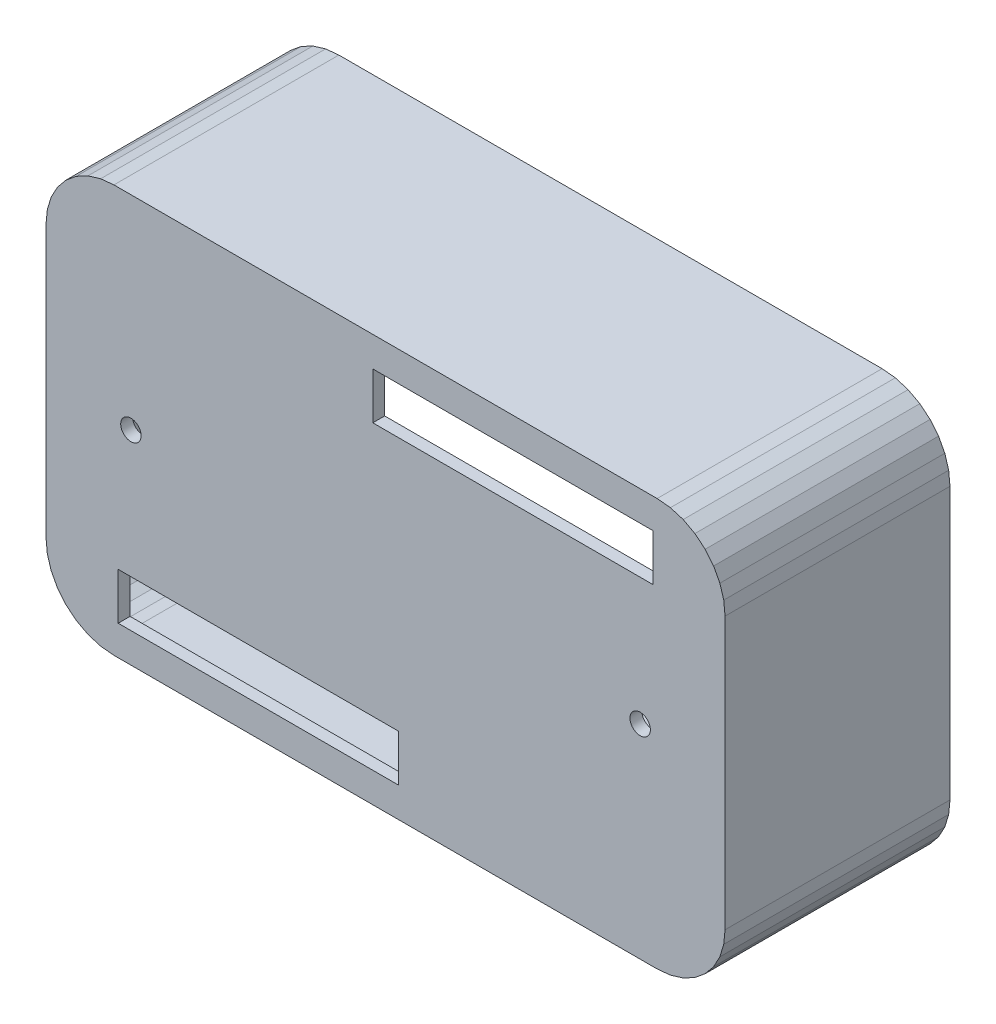
from build123d import *

# Parameters (mm, degrees)
BOSS_EXTRUDE1_START     = -2.5
BOSS_EXTRUDE1_DEPTH     = 26.5
CUT_EXTRUDE1_START      = -3
CUT_EXTRUDE1_DEPTH      = 25.6
CUT_EXTRUDE2_DEPTH      = 53.459508194
CUT_EXTRUDE2_DEPTH_BACK = 53.459508194
SKETCH3_W               = 33
SKETCH3_H               = 5.5
CUT_EXTRUDE3_DEPTH      = 53.459508194
CUT_EXTRUDE3_DEPTH_BACK = 53.459508194
SKETCH4_R               = 1.2


with BuildPart() as part:
    # Sketch1 → Boss-Extrude1 (new body)
    with BuildSketch(Plane.XY.offset(BOSS_EXTRUDE1_START)):
        Polygon((40, 16), (39.846282243, 17.560722576), (39.39103626, 19.061467459), (38.651756898, 20.444561864), (37.656854249, 21.656854249), (36.444561864, 22.651756898), (35.061467459, 23.39103626), (33.560722576, 23.846282243), (32, 24), (-32, 24), (-33.560722576, 23.846282243), (-35.061467459, 23.39103626), (-36.444561864, 22.651756898), (-37.656854249, 21.656854249), (-38.651756898, 20.444561864), (-39.39103626, 19.061467459), (-39.846282243, 17.560722576), (-40, 16), (-40, -16), (-39.846282243, -17.560722576), (-39.39103626, -19.061467459), (-38.651756898, -20.444561864), (-37.656854249, -21.656854249), (-36.444561864, -22.651756898), (-35.061467459, -23.39103626), (-33.560722576, -23.846282243), (-32, -24), (32, -24), (33.560722576, -23.846282243), (35.061467459, -23.39103626), (36.444561864, -22.651756898), (37.656854249, -21.656854249), (38.651756898, -20.444561864), (39.39103626, -19.061467459), (39.846282243, -17.560722576), (40, -16), align=None)
    extrude(amount=BOSS_EXTRUDE1_DEPTH)

    # Sketch2 → Cut-Extrude1 (cut)
    with BuildSketch(Plane.XY.offset(CUT_EXTRUDE1_START)):
        Polygon((38.4, 16), (38.277025795, 17.248578061), (37.912829008, 18.449173967), (37.321405519, 19.555649491), (36.5254834, 20.5254834), (35.555649491, 21.321405519), (34.449173967, 21.912829008), (33.248578061, 22.277025795), (32, 22.4), (-32, 22.4), (-33.248578061, 22.277025795), (-34.449173967, 21.912829008), (-35.555649491, 21.321405519), (-36.5254834, 20.5254834), (-37.321405519, 19.555649491), (-37.912829008, 18.449173967), (-38.277025795, 17.248578061), (-38.4, 16), (-38.4, -16), (-38.277025795, -17.248578061), (-37.912829008, -18.449173967), (-37.321405519, -19.555649491), (-36.5254834, -20.5254834), (-35.555649491, -21.321405519), (-34.449173967, -21.912829008), (-33.248578061, -22.277025795), (-32, -22.4), (32, -22.4), (33.248578061, -22.277025795), (34.449173967, -21.912829008), (35.555649491, -21.321405519), (36.5254834, -20.5254834), (37.321405519, -19.555649491), (37.912829008, -18.449173967), (38.277025795, -17.248578061), (38.4, -16), align=None)
    extrude(amount=CUT_EXTRUDE1_DEPTH, mode=Mode.SUBTRACT)

    # Sketch3 → Cut-Extrude2 (cut, two sides: drawn at the far end of the back side and taken through both)
    with BuildSketch(Plane.XY.offset(-CUT_EXTRUDE2_DEPTH_BACK)):
        with Locations((15, 17.725)):
            Rectangle(SKETCH3_W, SKETCH3_H)
        with Locations((-15, -17.725)):
            Rectangle(SKETCH3_W, SKETCH3_H)
    extrude(amount=CUT_EXTRUDE2_DEPTH + CUT_EXTRUDE2_DEPTH_BACK, mode=Mode.SUBTRACT)

    # Sketch4 → Cut-Extrude3 (cut, two sides: drawn at the far end of the back side and taken through both)
    with BuildSketch(Plane.XY.offset(-CUT_EXTRUDE3_DEPTH_BACK)):
        with Locations((30, 0)):
            Circle(SKETCH4_R)
        with Locations((-30, 0)):
            Circle(SKETCH4_R)
    extrude(amount=CUT_EXTRUDE3_DEPTH + CUT_EXTRUDE3_DEPTH_BACK, mode=Mode.SUBTRACT)


solid = part.part
